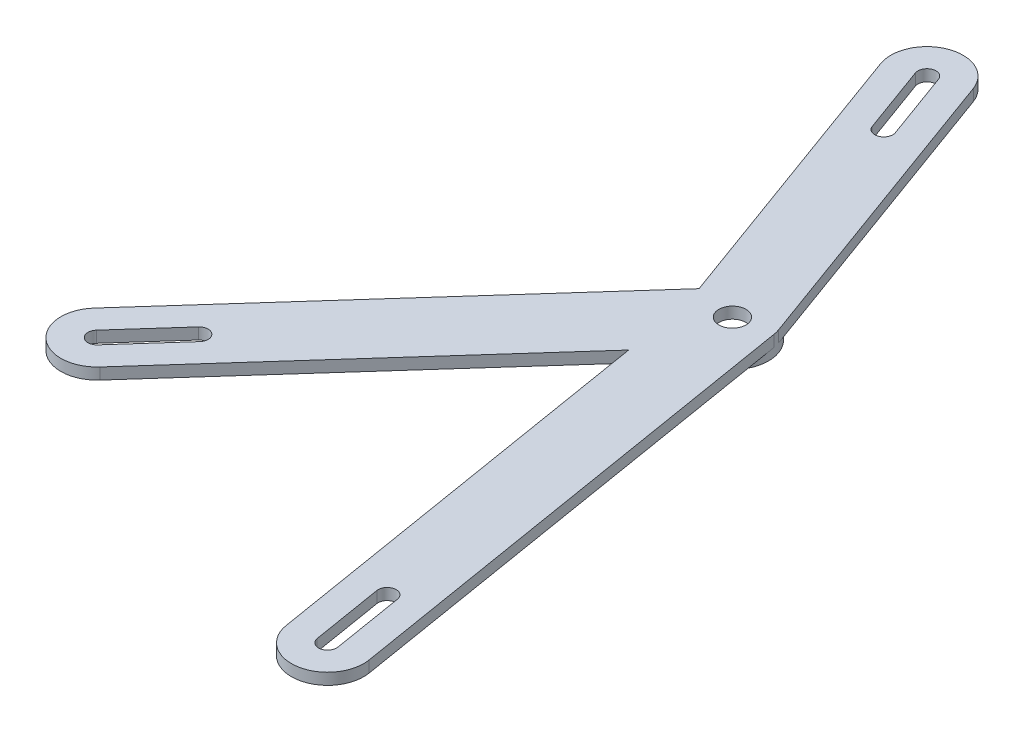
from build123d import *

# Parameters (mm, degrees)
BOSS_EXTRUDE1_DEPTH = 4
BOSS_EXTRUDE2_START = -7
SKETCH3_R           = 12.7
BOSS_EXTRUDE2_DEPTH = 7
SKETCH5_R           = 4.7625
CUT_EXTRUDE1_DEPTH  = 272.846418627
SKETCH6_R           = 12.192
CUT_EXTRUDE2_DEPTH  = 3
SKETCH8_R           = 3.175
CUT_EXTRUDE3_DEPTH  = 272.846418627
CUT_EXTRUDE4_DEPTH  = 272.846418627


with BuildPart() as part:
    # Sketch1 → Boss-Extrude1 (new body)
    with BuildSketch(Plane(origin=(0, 0, 0), x_dir=(1, 0, 0), z_dir=(0, 1, 0))):
        with BuildLine():
            Line((-55.078065391, 65.670374736), (-15.882456002, -41.901827969))
            ThreePointArc((-15.882456002, -41.901827969), (-15.529329867, -43.032283758), (-15.283044075, -44.190718765))
            Line((-15.283044075, -44.190718765), (12.6911511, -214.459876374))
            ThreePointArc((12.6911511, -214.459876374), (2.218090383, -229.050798182), (-12.372831425, -218.577737465))
            Line((-12.372831425, -218.577737465), (-36.044890736, -74.494178583))
            Line((-36.044890736, -74.494178583), (-123.815593368, -172.591431542))
            ThreePointArc((-123.815593368, -172.591431542), (-141.748449811, -173.587754678), (-142.744772948, -155.654898235))
            Line((-142.744772948, -155.654898235), (-42.351793784, -43.450310863))
            Line((-42.351793784, -43.450310863), (-78.943224061, 56.974732054))
            ThreePointArc((-78.943224061, 56.974732054), (-71.358466067, 73.25513273), (-55.078065391, 65.670374736))
        make_face()
    extrude(amount=BOSS_EXTRUDE1_DEPTH)

    # Sketch3 → Boss-Extrude2 (add)
    with BuildSketch(Plane(origin=(0, 4, 0), x_dir=(1, 0, 0), z_dir=(0, 1, 0)).offset(BOSS_EXTRUDE2_START)):
        with Locations(Location((-27.815035337, -46.24964931, 0), (0, 0, 20.02))):
            Circle(SKETCH3_R)
    extrude(amount=BOSS_EXTRUDE2_DEPTH)

    # Sketch5 → Cut-Extrude1 (cut, through all)
    with BuildSketch(Plane(origin=(0, 4, 0), x_dir=(1, 0, 0), z_dir=(0, 1, 0))):
        with Locations(Location((-27.815035337, -46.24964931, 0), (0, 0, 270))):
            Circle(SKETCH5_R)
    extrude(amount=-CUT_EXTRUDE1_DEPTH, mode=Mode.SUBTRACT)

    # Sketch6 → Cut-Extrude2 (cut)
    with BuildSketch(Plane(origin=(0, -3, 0), x_dir=(-1, 0, 0), z_dir=(0, -1, 0))):
        with Locations(Location((27.815035337, -46.24964931, 0), (0, 0, 90))):
            Circle(SKETCH6_R)
    extrude(amount=-CUT_EXTRUDE2_DEPTH, mode=Mode.SUBTRACT)

    # Sketch8 → Cut-Extrude3 (cut, through all)
    with BuildSketch(Plane(origin=(0, 4, 0), x_dir=(1, 0, 0), z_dir=(0, 1, 0))):
        with Locations(Location((-67.010644726, 61.322553395, 0), (0, 0, 270))):
            Circle(SKETCH8_R)
        with Locations(Location((0.159159837, -216.518806919, 0), (0, 0, 270))):
            Circle(SKETCH8_R)
        with Locations(Location((-133.280183158, -164.123164888, 0), (0, 0, 270))):
            Circle(SKETCH8_R)
    extrude(amount=-CUT_EXTRUDE3_DEPTH, mode=Mode.SUBTRACT)

    # Sketch10 → Cut-Extrude4 (cut, through all)
    with BuildSketch(Plane(origin=(0, 4, 0), x_dir=(1, 0, 0), z_dir=(0, 1, 0))):
        with BuildLine():
            Line((-64.027499893, 62.40950873), (-55.331857211, 38.54435006))
            ThreePointArc((-55.331857211, 38.54435006), (-57.228046709, 34.474249891), (-61.298146878, 36.37043939))
            Line((-61.298146878, 36.37043939), (-69.99378956, 60.23559806))
            ThreePointArc((-69.99378956, 60.23559806), (-68.097600062, 64.305698229), (-64.027499893, 62.40950873))
        make_face()
        with BuildLine():
            Line((-135.646330605, -162.006098225), (-118.709797299, -143.076918645))
            ThreePointArc((-118.709797299, -143.076918645), (-114.226583188, -142.827837861), (-113.977502404, -147.311051972))
            Line((-113.977502404, -147.311051972), (-130.91403571, -166.240231552))
            ThreePointArc((-130.91403571, -166.240231552), (-135.397249821, -166.489312336), (-135.646330605, -162.006098225))
        make_face()
        with BuildLine():
            Line((-2.973837978, -217.033539556), (-7.091699069, -191.96955703))
            ThreePointArc((-7.091699069, -191.96955703), (-4.473433889, -188.321826578), (-0.825703437, -190.940091758))
            Line((-0.825703437, -190.940091758), (3.292157653, -216.004074283))
            ThreePointArc((3.292157653, -216.004074283), (0.673892474, -219.651804735), (-2.973837978, -217.033539556))
        make_face()
    extrude(amount=-CUT_EXTRUDE4_DEPTH, mode=Mode.SUBTRACT)


solid = part.part
